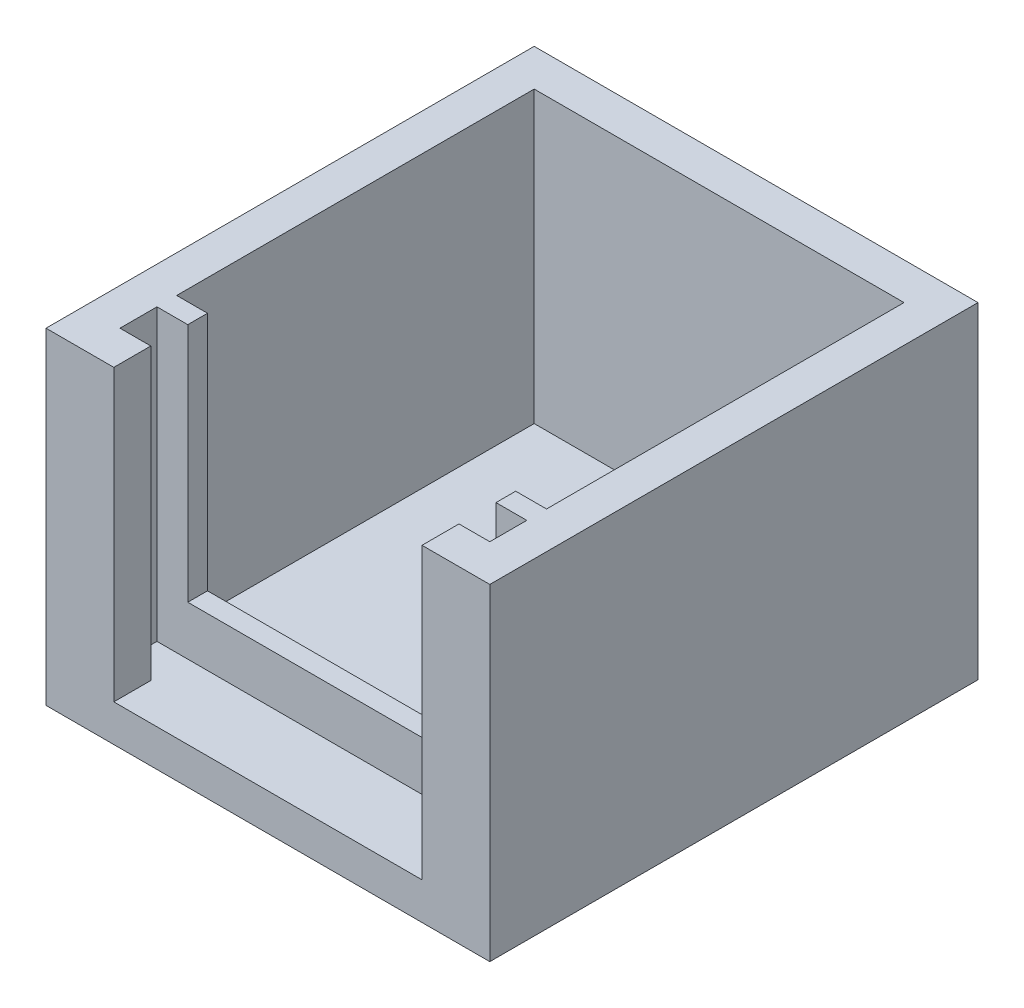
from build123d import *

# Parameters (mm, degrees)
BOSS_EXTRUDE1_DEPTH = 23.5
SKETCH2_W           = 36
SKETCH2_H           = 39.6
BOSS_EXTRUDE2_DEPTH = 3
CUT_EXTRUDE3_REACH  = 67.916
SKETCH5_W           = 25
SKETCH5_H           = 19.5


with BuildPart() as part:
    # Sketch1 → Boss-Extrude1 (new body)
    with BuildSketch(Plane(origin=(0, 0, 0), x_dir=(1, 0, 0), z_dir=(0, 1, 0))):
        Polygon((-48.611740356, -17.456705616), (-48.611740356, -16.615368715), (-48.611740356, -14.456705616), (-48.611740356, -12.856705616), (-48.611740356, 16.143294384), (-48.611740356, 19.143294384), (-51.611740356, 19.143294384), (-51.611740356, -20.456705616), (-46.111740356, -20.456705616), (-46.111740356, -17.456705616), align=None)
        Polygon((-48.611740356, -12.856705616), (-48.611740356, -14.456705616), (-18.611740356, -14.456705616), (-18.611740356, -17.456705616), (-21.111740356, -17.456705616), (-21.111740356, -20.456705616), (-15.611740356, -20.456705616), (-15.611740356, 19.143294384), (-48.611740356, 19.143294384), (-48.611740356, 16.143294384), (-18.611740356, 16.143294384), (-18.611740356, -12.856705616), align=None)
    extrude(amount=BOSS_EXTRUDE1_DEPTH)

    # Sketch2 → Boss-Extrude2 (add)
    with BuildSketch(Plane.XZ):
        with Locations((-33.611740356, 0.656705616)):
            Rectangle(SKETCH2_W, SKETCH2_H)
    extrude(amount=BOSS_EXTRUDE2_DEPTH)

    # Sketch5 → Cut-Extrude3 (cut, up to next)
    with BuildSketch(Plane.XY.offset(14.456705616), mode=Mode.PRIVATE) as cut_extrude3_sk1:
        with Locations((-33.611740356, 13.75)):
            Rectangle(SKETCH5_W, SKETCH5_H)
    cut_extrude3_tool1 = extrude(cut_extrude3_sk1.sketch, amount=-CUT_EXTRUDE3_REACH, mode=Mode.PRIVATE) & part.part
    add(cut_extrude3_tool1.solids().sort_by_distance((-33.61174, 13.75, 14.456706))[0], mode=Mode.SUBTRACT)


solid = part.part
